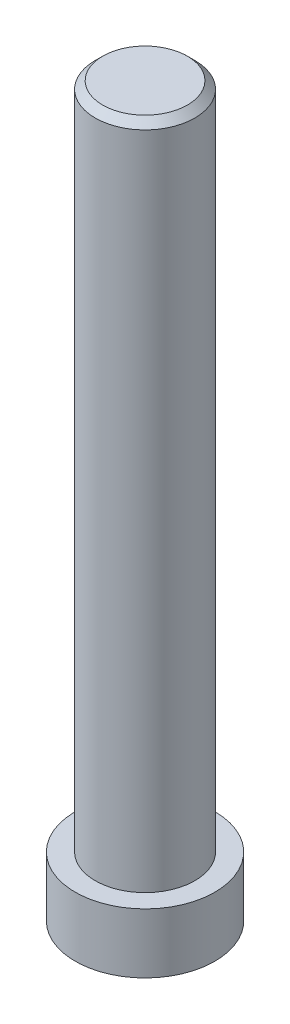
from build123d import *

# Parameters (mm, degrees)
SKETCH1_R           = 5
BOSS_EXTRUDE1_DEPTH = 67
CHAMFER1_SIZE       = 0.75
SKETCH2_R           = 7
BOSS_EXTRUDE2_DEPTH = 6
CUT_EXTRUDE1_DEPTH  = 3.8


with BuildPart() as part:
    # Sketch1 → Boss-Extrude1 (new body)
    with BuildSketch(Plane(origin=(0, 0, 0), x_dir=(1, 0, 0), z_dir=(0, 1, 0))):
        with Locations(Location((0, 0, 0), (0, 0, 270))):
            Circle(SKETCH1_R)
    extrude(amount=BOSS_EXTRUDE1_DEPTH)

    # Chamfer1
    chamfer1_edges = [part.edges().sort_by_distance(p)[0] for p in [
        (0, 67, -5),
    ]]
    chamfer(chamfer1_edges, length=CHAMFER1_SIZE)

    # Sketch2 → Boss-Extrude2 (add)
    with BuildSketch(Plane.XZ):
        with Locations(Location((0, 0, 0), (0, 0, 270))):
            Circle(SKETCH2_R)
    extrude(amount=BOSS_EXTRUDE2_DEPTH)

    # Sketch3 → Cut-Extrude1 (cut)
    with BuildSketch(Plane.XZ.offset(6)):
        Polygon((0, 3.0022214), (-2.6, 1.5011107), (-2.6, -1.5011107), (0, -3.0022214), (2.6, -1.5011107), (2.6, 1.5011107), align=None)
    extrude(amount=-CUT_EXTRUDE1_DEPTH, mode=Mode.SUBTRACT)


solid = part.part
